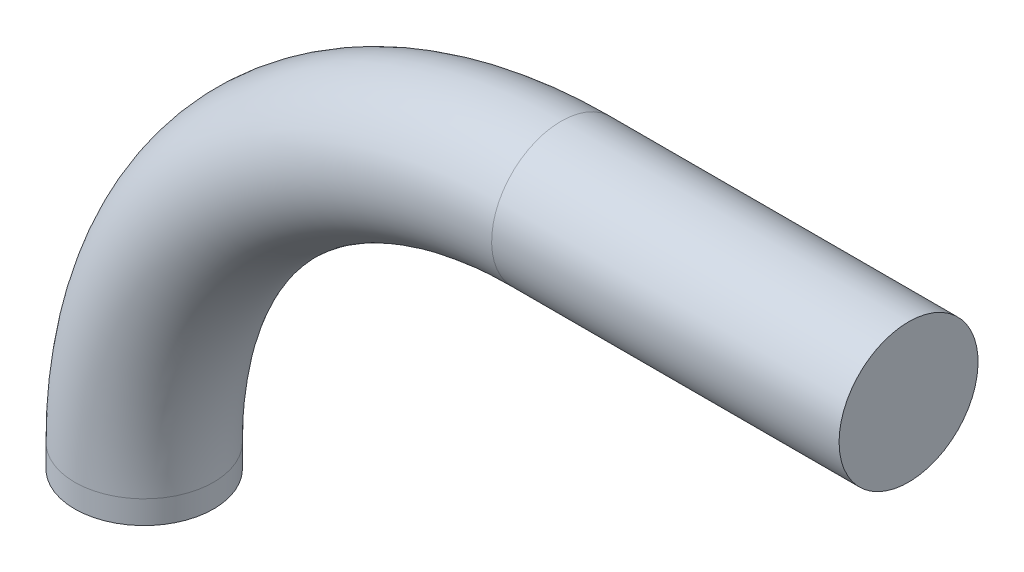
from build123d import *

# Parameters (mm, degrees)
SKETCH2_R = 3


with BuildPart() as part:
    # Sweep1: sweep along a path in Sketch1
    with BuildLine(Plane.XY) as sweep1_path:
        Line((0, 0), (0, 1))
        ThreePointArc((0, 1), (5.272077939, 13.727922061), (18, 19))
        Line((18, 19), (33, 19))
    # Sketch2 → Sweep1 (sweep)
    with BuildSketch(Plane(origin=(0, 0, 0), x_dir=(1, 0, 0), z_dir=(0, 1, 0))):
        Circle(SKETCH2_R)
    sweep(path=sweep1_path.line)


solid = part.part
